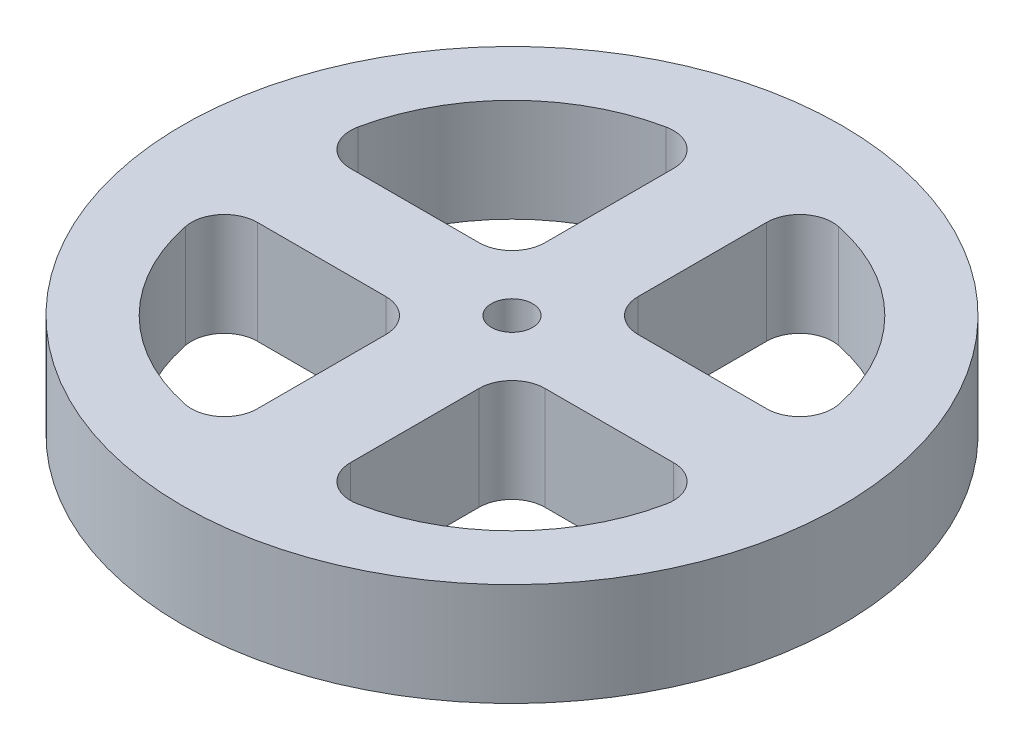
from build123d import *

# Parameters (mm, degrees)
SKETCH1_R           = 5.08
SKETCH1_R_2         = 0.3175
BOSS_EXTRUDE1_DEPTH = 1.5875
CUT_EXTRUDE1_DEPTH  = 8.357510194
FILLET1_R           = 0.508
FILLET2_R           = 0.508


with BuildPart() as part:
    # Sketch1 → Boss-Extrude1 (new body)
    with BuildSketch(Plane(origin=(0, 0, 0), x_dir=(1, 0, 0), z_dir=(0, 1, 0))):
        with Locations(Location((0, 0, 0), (0, 0, 270))):
            Circle(SKETCH1_R)
        with Locations(Location((0, 0, 0), (0, 0, 270))):
            Circle(SKETCH1_R_2, mode=Mode.SUBTRACT)
    extrude(amount=BOSS_EXTRUDE1_DEPTH)

    # Sketch2 → Cut-Extrude1 (cut, through all)
    with BuildSketch(Plane(origin=(0, 1.5875, 0), x_dir=(1, 0, 0), z_dir=(0, 1, 0))):
        with BuildLine():
            Line((-0.71842049, 0.71842049), (-0.71842049, 3.76642049))
            ThreePointArc((-0.71842049, 3.76642049), (-2.873681959, 2.873681959), (-3.76642049, 0.71842049))
            Line((-3.76642049, 0.71842049), (-0.71842049, 0.71842049))
        make_face()
        with BuildLine():
            Line((0.71842049, 0.71842049), (3.76642049, 0.71842049))
            ThreePointArc((3.76642049, 0.71842049), (2.873681959, 2.873681959), (0.71842049, 3.76642049))
            Line((0.71842049, 3.76642049), (0.71842049, 0.71842049))
        make_face()
        with BuildLine():
            Line((0.71842049, -0.71842049), (3.76642049, -0.71842049))
            ThreePointArc((3.76642049, -0.71842049), (2.873681959, -2.873681959), (0.71842049, -3.76642049))
            Line((0.71842049, -3.76642049), (0.71842049, -0.71842049))
        make_face()
        with BuildLine():
            Line((-0.71842049, -0.71842049), (-0.71842049, -3.76642049))
            ThreePointArc((-0.71842049, -3.76642049), (-2.873681959, -2.873681959), (-3.76642049, -0.71842049))
            Line((-3.76642049, -0.71842049), (-0.71842049, -0.71842049))
        make_face()
    extrude(amount=-CUT_EXTRUDE1_DEPTH, mode=Mode.SUBTRACT)

    # Fillet1
    fillet1_edges = [part.edges().sort_by_distance(p)[0] for p in [
        (-0.71842049, 0.79375, -0.71842049),
        (0.71842049, 0.79375, -0.71842049),
        (0.71842049, 0.79375, 0.71842049),
        (-0.71842049, 0.79375, 0.71842049),
    ]]
    fillet(fillet1_edges, radius=FILLET1_R)

    # Fillet2
    fillet2_edges = [part.edges().sort_by_distance(p)[0] for p in [
        (-3.76642049, 0.79375, -0.71842049),
        (-0.71842049, 0.79375, -3.76642049),
        (0.71842049, 0.79375, -3.76642049),
        (3.76642049, 0.79375, -0.71842049),
        (0.71842049, 0.79375, 3.76642049),
        (3.76642049, 0.79375, 0.71842049),
        (-3.76642049, 0.79375, 0.71842049),
        (-0.71842049, 0.79375, 3.76642049),
    ]]
    fillet(fillet2_edges, radius=FILLET2_R)


solid = part.part
